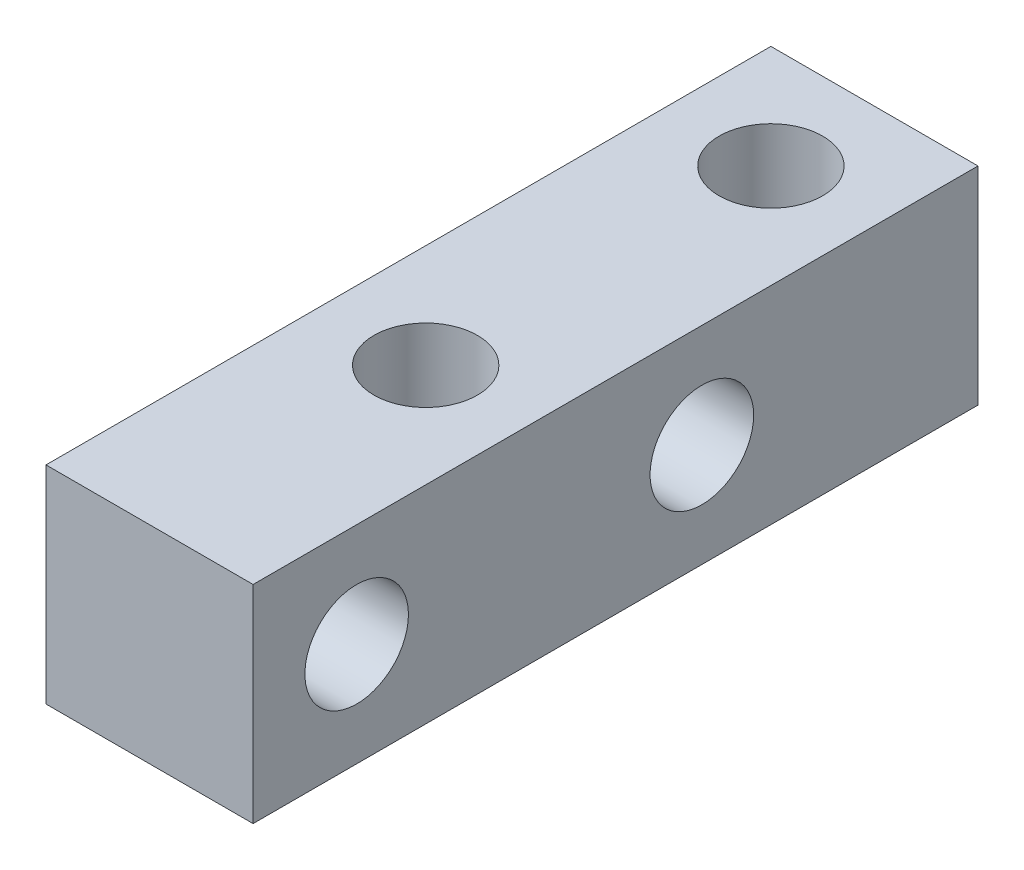
from build123d import *

# Parameters (mm, degrees)
SKETCH_1_W          = 6
SKETCH_1_H          = 6
EXTRUDE_1_DEPTH     = 21
SKETCH_2_R          = 1.5
CUT_EXTRUDE_1_DEPTH = 23.045407685
SKETCH_3_R          = 1.5
CUT_EXTRUDE_2_DEPTH = 23.045407685


with BuildPart() as part:
    # 草图1 → 凸台-拉伸1 (new body)
    with BuildSketch(Plane.XY):
        Rectangle(SKETCH_1_W, SKETCH_1_H)
    extrude(amount=EXTRUDE_1_DEPTH)

    # 草图2 → 切除-拉伸1 (cut, through all)
    with BuildSketch(Plane(origin=(0, 3, 0), x_dir=(1, 0, 0), z_dir=(0, 1, 0))):
        with Locations(Location((0, -3, 0), (0, 0, 270))):
            Circle(SKETCH_2_R)
        with Locations(Location((0, -13, 0), (0, 0, 270))):
            Circle(SKETCH_2_R)
    extrude(amount=-CUT_EXTRUDE_1_DEPTH, mode=Mode.SUBTRACT)

    # 草图3 → 切除-拉伸2 (cut, through all)
    with BuildSketch(Plane(origin=(3, 0, 0), x_dir=(0, 0, -1), z_dir=(1, 0, 0))):
        with Locations((-18, 0)):
            Circle(SKETCH_3_R)
        with Locations((-8, 0)):
            Circle(SKETCH_3_R)
    extrude(amount=-CUT_EXTRUDE_2_DEPTH, mode=Mode.SUBTRACT)


solid = part.part
